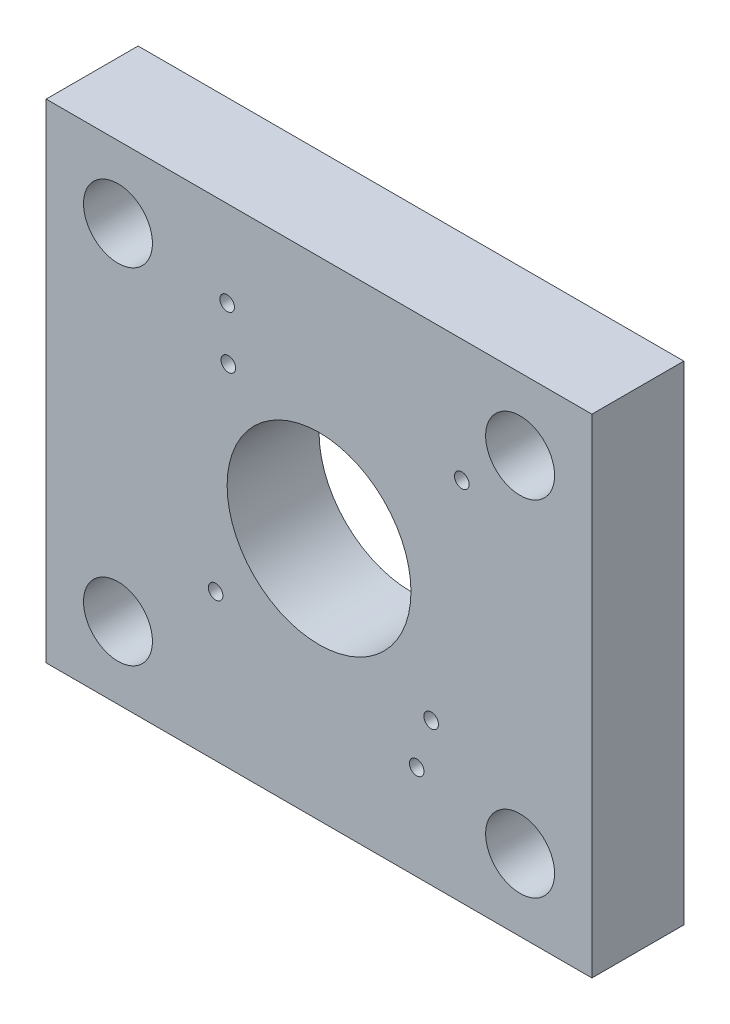
from build123d import *

# Parameters (mm, degrees)
SKETCH1_W           = 9.5
SKETCH1_H           = 8.5
BOARD_OUTLINE_DEPTH = 1.6
SKETCH2_R           = 0.6
SKETCH2_R_2         = 1.6
SKETCH2_R_3         = 0.127
NPTH_DEPTH          = 13.49739973


with BuildPart() as part:
    # Sketch1 → Board_Outline (new body)
    with BuildSketch(Plane.XY):
        with Locations((4.5, 4)):
            Rectangle(SKETCH1_W, SKETCH1_H)
    extrude(amount=BOARD_OUTLINE_DEPTH)

    # Sketch2 → NPTH (cut, through all)
    with BuildSketch(Plane.XY):
        with Locations((8, 7)):
            Circle(SKETCH2_R)
        with Locations((1, 7)):
            Circle(SKETCH2_R)
        with Locations((1, 1)):
            Circle(SKETCH2_R)
        with Locations((8, 1)):
            Circle(SKETCH2_R)
        with Locations((4.5, 4)):
            Circle(SKETCH2_R_2)
        with Locations((2.7, 2.3)):
            Circle(SKETCH2_R_3)
        with Locations((6.2, 1.4)):
            Circle(SKETCH2_R_3)
        with Locations((2.9, 6.7492)):
            Circle(SKETCH2_R_3)
        with Locations((2.921, 5.842)):
            Circle(SKETCH2_R_3)
        with Locations((6.4516, 2.2352)):
            Circle(SKETCH2_R_3)
        with Locations((6.985, 6.1214)):
            Circle(SKETCH2_R_3)
    extrude(amount=NPTH_DEPTH, mode=Mode.SUBTRACT)


solid = part.part
